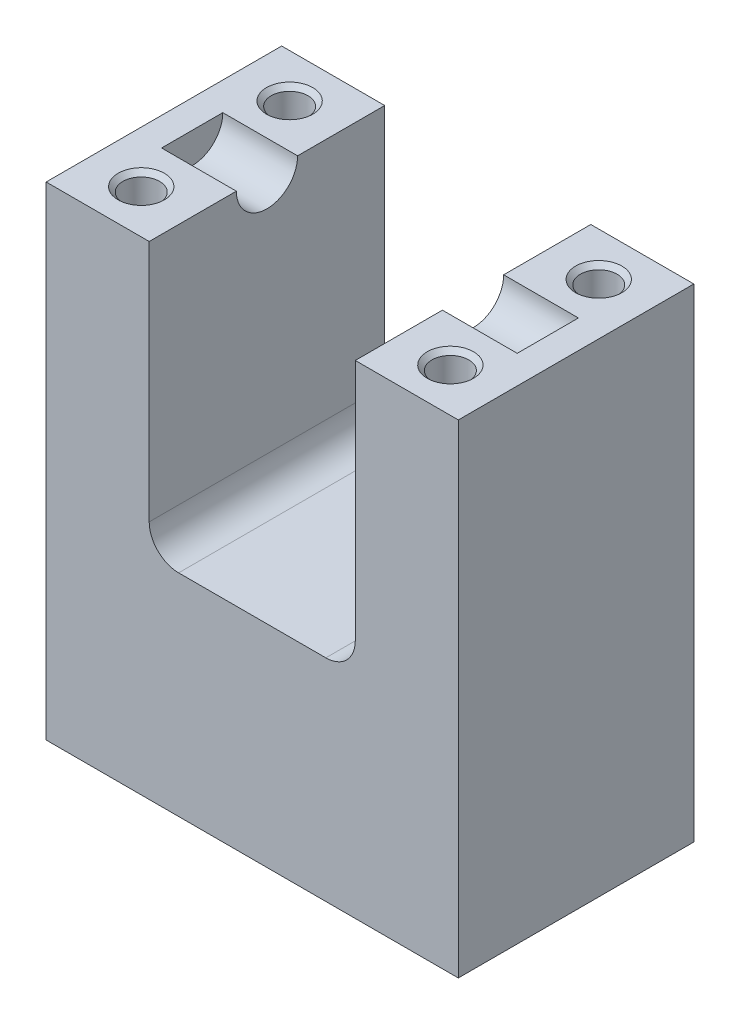
from build123d import *

# Parameters (mm, degrees)
L_BASE_DEPTH                                = 12.7
SKETCH3_W                                   = 44.45
SKETCH3_H                                   = 25.4
RECTANGULAR_EXTRUDE_DEPTH                   = 10.5664
SKETCH4_W                                   = 11.1125
SKETCH4_H                                   = 25.4
FORK_EXTRUDE_DEPTH                          = 29.3624
SKETCH6_W                                   = 38.354
SKETCH6_H                                   = 3.302
F_4_EXPANSION_INSERT_RECESSES_1_D           = 3.2639
F_4_EXPANSION_INSERT_RECESSES_1_DEPTH       = 12.7
F_4_EXPANSION_INSERT_RECESSES_1_CBORE_D     = 3.96875
F_4_EXPANSION_INSERT_RECESSES_1_CBORE_DEPTH = 4.7625
F_4_EXPANSION_INSERT_RECESSES_1_TIP         = 0.980574487
F_4_EXPANSION_INSERT_RECESSES_2_D           = 3.2639
F_4_EXPANSION_INSERT_RECESSES_2_DEPTH       = 9.525
F_4_EXPANSION_INSERT_RECESSES_2_CBORE_D     = 3.96875
F_4_EXPANSION_INSERT_RECESSES_2_CBORE_DEPTH = 4.7625
F_4_EXPANSION_INSERT_RECESSES_2_TIP         = 0.980574487
L_BASE_FILLET_R                             = 6.35
FORK_FILLET_R                               = 3.175
INSTALLATION_CHAMFERS_1_SIZE                = 0.508
INSTALLATION_CHAMFERS_2_SIZE                = 0.508
PRINT_BED_CHAMFER_SIZE                      = 0.508


with BuildPart() as part:
    # Sketch1 → L-Base (new body)
    with BuildSketch(Plane(origin=(0, 0, 0), x_dir=(1, 0, 0), z_dir=(0, 1, 0))):
        Polygon((0, 0), (44.45, 0), (44.45, 25.4), (20.066, 25.4), (20.066, 39.116), (0, 39.116), align=None)
    extrude(amount=L_BASE_DEPTH)

    # Sketch3 → Rectangular Extrude (add)
    with BuildSketch(Plane(origin=(0, 12.7, 0), x_dir=(1, 0, 0), z_dir=(0, 1, 0))):
        with Locations((22.225, 12.7)):
            Rectangle(SKETCH3_W, SKETCH3_H)
    extrude(amount=RECTANGULAR_EXTRUDE_DEPTH)

    # Sketch4 → Fork Extrude (add)
    with BuildSketch(Plane(origin=(0, 23.2664, 0), x_dir=(1, 0, 0), z_dir=(0, 1, 0))):
        with Locations((5.55625, 12.7)):
            Rectangle(SKETCH4_W, SKETCH4_H)
        with Locations((38.89375, 12.7)):
            Rectangle(SKETCH4_W, SKETCH4_H)
    extrude(amount=FORK_EXTRUDE_DEPTH)

    # Sketch6 → Shaft Recess (revolve, cut)
    with BuildSketch(Plane(origin=(0, 52.6288, 0), x_dir=(1, 0, 0), z_dir=(0, 1, 0))):
        with Locations((22.225, 11.049)):
            Rectangle(SKETCH6_W, SKETCH6_H)
    revolve(axis=Axis((0, 52.6288, -12.7), (1, 0, 0)), mode=Mode.SUBTRACT)

    # #4 Expansion Insert Recesses #1
    with Locations(Plane(origin=(0, 52.6288, 0), x_dir=(1, 0, 0), z_dir=(0, 1, 0))):
        with Locations((5.55625, 20.701), (5.55625, 4.699), (38.89375, 20.701), (38.89375, 4.699)):
            CounterBoreHole(F_4_EXPANSION_INSERT_RECESSES_1_D / 2, F_4_EXPANSION_INSERT_RECESSES_1_CBORE_D / 2, F_4_EXPANSION_INSERT_RECESSES_1_CBORE_DEPTH, depth=F_4_EXPANSION_INSERT_RECESSES_1_DEPTH)
            with Locations((0, 0, -(F_4_EXPANSION_INSERT_RECESSES_1_DEPTH + F_4_EXPANSION_INSERT_RECESSES_1_TIP / 2))):  # 118° drill point
                Cone(0, F_4_EXPANSION_INSERT_RECESSES_1_D / 2, F_4_EXPANSION_INSERT_RECESSES_1_TIP, mode=Mode.SUBTRACT)

    # #4 Expansion Insert Recesses #2
    with Locations(Plane(origin=(0, 0, 0), x_dir=(-1, 0, 0), z_dir=(0, -1, 0))):
        with Locations((-10.033, 10.033), (-28.956, 10.033), (-10.033, 28.956)):
            CounterBoreHole(F_4_EXPANSION_INSERT_RECESSES_2_D / 2, F_4_EXPANSION_INSERT_RECESSES_2_CBORE_D / 2, F_4_EXPANSION_INSERT_RECESSES_2_CBORE_DEPTH, depth=F_4_EXPANSION_INSERT_RECESSES_2_DEPTH)
            with Locations((0, 0, -(F_4_EXPANSION_INSERT_RECESSES_2_DEPTH + F_4_EXPANSION_INSERT_RECESSES_2_TIP / 2))):  # 118° drill point
                Cone(0, F_4_EXPANSION_INSERT_RECESSES_2_D / 2, F_4_EXPANSION_INSERT_RECESSES_2_TIP, mode=Mode.SUBTRACT)

    # L-Base Fillet
    l_base_fillet_edges = [part.edges().sort_by_distance(p)[0] for p in [
        (10.033, 12.7, -39.116),
        (10.033, 12.7, -25.4),
        (20.066, 6.35, -25.4),
    ]]
    fillet(l_base_fillet_edges, radius=L_BASE_FILLET_R)

    # Fork Fillet
    fork_fillet_edges = [part.edges().sort_by_distance(p)[0] for p in [
        (33.3375, 23.2664, -12.7),
        (11.1125, 23.2664, -12.7),
    ]]
    fillet(fork_fillet_edges, radius=FORK_FILLET_R)

    # Installation Chamfers #1
    installation_chamfers_1_edges = [part.edges().sort_by_distance(p)[0] for p in [
        (36.909375, 52.6288, -4.699),
        (36.909375, 52.6288, -20.701),
        (3.571875, 52.6288, -4.699),
        (3.571875, 52.6288, -20.701),
    ]]
    chamfer(installation_chamfers_1_edges, length=INSTALLATION_CHAMFERS_1_SIZE)

    # Installation Chamfers #2
    installation_chamfers_2_edges = [part.edges().sort_by_distance(p)[0] for p in [
        (30.940375, 0, -10.033),
        (12.017375, 0, -10.033),
        (12.017375, 0, -28.956),
    ]]
    chamfer(installation_chamfers_2_edges, length=INSTALLATION_CHAMFERS_2_SIZE)

    # Print Bed Chamfer
    print_bed_chamfer_edges = [part.edges().sort_by_distance(p)[0] for p in [
        (20.066, 0, -35.433),
        (21.925871939, 0, -27.259871939),
        (10.033, 0, -39.116),
        (35.433, 0, -25.4),
        (44.45, 0, -12.7),
        (22.225, 0, 0),
        (0, 0, -19.558),
    ]]
    chamfer(print_bed_chamfer_edges, length=PRINT_BED_CHAMFER_SIZE)


solid = part.part
